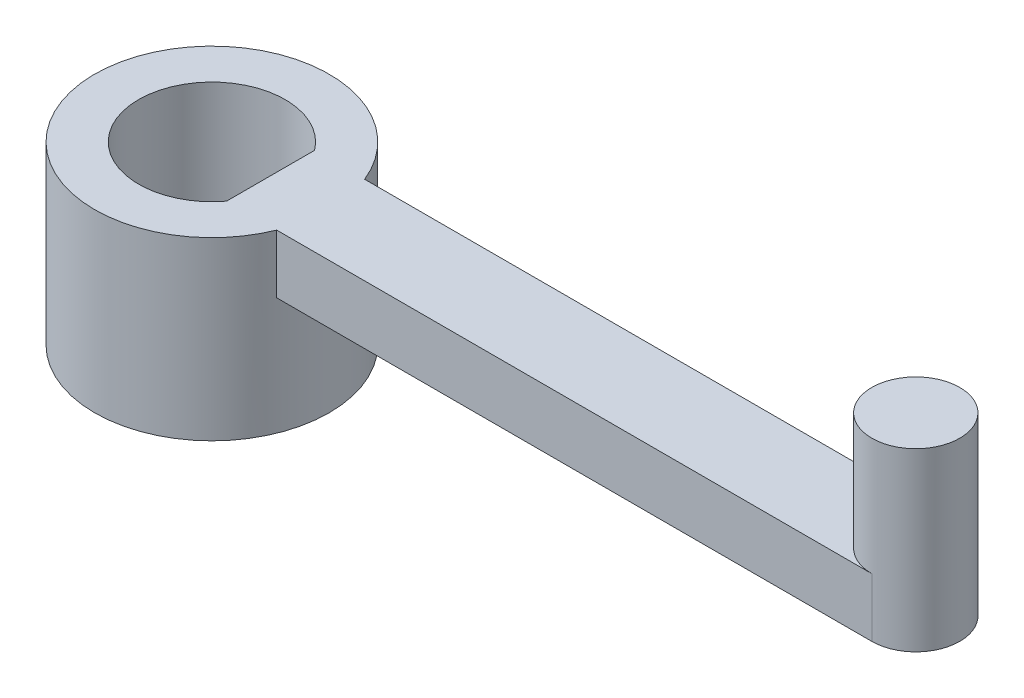
from build123d import *

# Parameters (mm, degrees)
BOSS_EXTRUDE1_DEPTH = 6.35
SKETCH1_3_R         = 12.7
BOSS_EXTRUDE2_DEPTH = 19.05
BOSS_EXTRUDE3_START = 12.7
SKETCH1_4_R         = 4.7625
BOSS_EXTRUDE3_DEPTH = 12.7


with BuildPart() as part:
    # Sketch1 → Boss-Extrude1 (new body)
    with BuildSketch(Plane(origin=(0, 0, 0), x_dir=(1, 0, 0), z_dir=(0, 1, 0))):
        with BuildLine():
            Line((76.2, 4.7625), (11.773215098, 4.7625))
            ThreePointArc((11.773215098, 4.7625), (12.7, 0), (11.773215098, -4.7625))
            Line((11.773215098, -4.7625), (76.2, -4.7625))
            ThreePointArc((76.2, -4.7625), (80.9625, 0), (76.2, 4.7625))
        make_face()
    extrude(amount=-BOSS_EXTRUDE1_DEPTH)

    # Sketch1<3> → Boss-Extrude2 (add)
    with BuildSketch(Plane(origin=(0, 0, 0), x_dir=(1, 0, 0), z_dir=(0, 1, 0))):
        Circle(SKETCH1_3_R)
        with BuildLine():
            ThreePointArc((6.35, -4.7625), (-7.9375, 0), (6.35, 4.7625))
            Line((6.35, 4.7625), (6.35, -4.7625))
        make_face(mode=Mode.SUBTRACT)
    extrude(amount=-BOSS_EXTRUDE2_DEPTH)

    # Sketch1<4> → Boss-Extrude3 (add)
    with BuildSketch(Plane(origin=(0, 0, 0), x_dir=(1, 0, 0), z_dir=(0, 1, 0)).offset(BOSS_EXTRUDE3_START)):
        with Locations((76.2, 0)):
            Circle(SKETCH1_4_R)
    extrude(amount=-BOSS_EXTRUDE3_DEPTH)


solid = part.part
